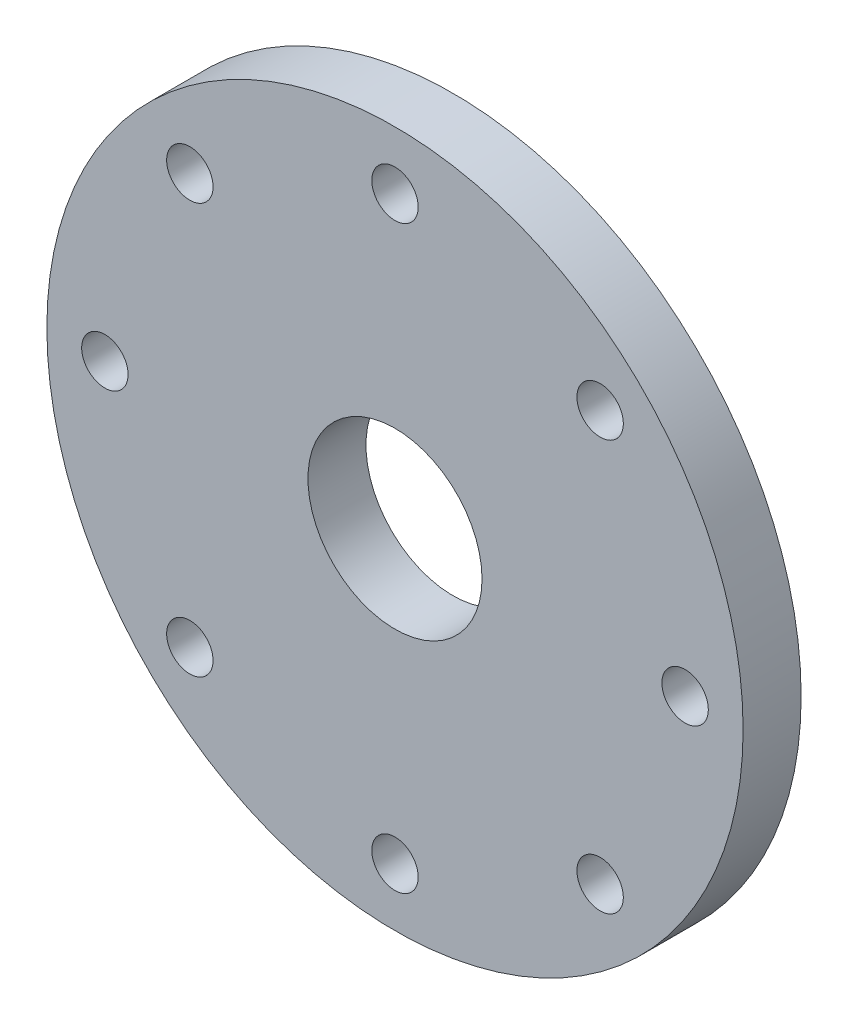
from build123d import *

# Parameters (mm, degrees)
SKETCH1_R           = 19.05
SKETCH1_R_2         = 1.27
SKETCH1_R_3         = 4.7625
BOSS_EXTRUDE1_DEPTH = 3.175


with BuildPart() as part:
    # Sketch1 → Boss-Extrude1 (new body)
    with BuildSketch(Plane.XY):
        Circle(SKETCH1_R)
        with Locations((0, 15.875)):
            Circle(SKETCH1_R_2, mode=Mode.SUBTRACT)
        with Locations((11.225320151, 11.225320151)):
            Circle(SKETCH1_R_2, mode=Mode.SUBTRACT)
        with Locations((15.875, 0)):
            Circle(SKETCH1_R_2, mode=Mode.SUBTRACT)
        Circle(SKETCH1_R_3, mode=Mode.SUBTRACT)
        with Locations((11.225320151, -11.225320151)):
            Circle(SKETCH1_R_2, mode=Mode.SUBTRACT)
        with Locations((0, -15.875)):
            Circle(SKETCH1_R_2, mode=Mode.SUBTRACT)
        with Locations((-11.225320151, -11.225320151)):
            Circle(SKETCH1_R_2, mode=Mode.SUBTRACT)
        with Locations((-15.875, 0)):
            Circle(SKETCH1_R_2, mode=Mode.SUBTRACT)
        with Locations((-11.225320151, 11.225320151)):
            Circle(SKETCH1_R_2, mode=Mode.SUBTRACT)
    extrude(amount=BOSS_EXTRUDE1_DEPTH)


solid = part.part
